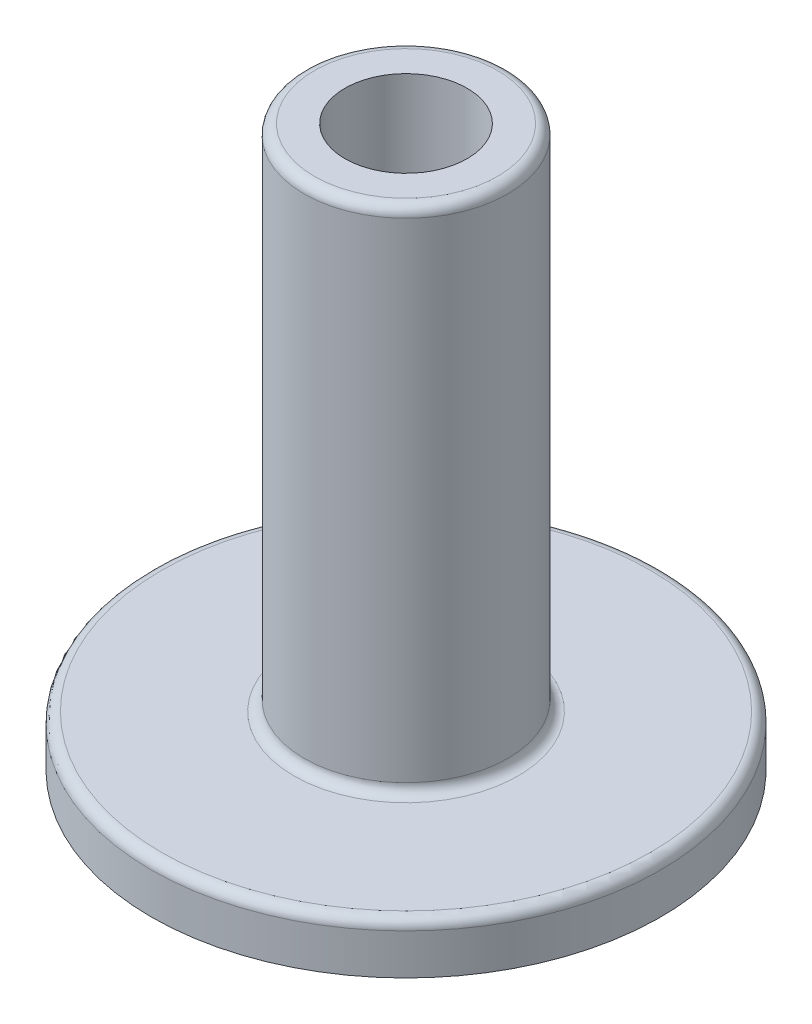
from build123d import *

# Parameters (mm, degrees)
SKETCH1_R           = 25
BOSS_EXTRUDE1_DEPTH = 5
SKETCH2_R           = 10
SKETCH2_R_2         = 6
BOSS_EXTRUDE2_DEPTH = 50
FILLET1_R           = 1


with BuildPart() as part:
    # Sketch1 → Boss-Extrude1 (new body)
    with BuildSketch(Plane(origin=(0, 0, 0), x_dir=(1, 0, 0), z_dir=(0, 1, 0))):
        with Locations(Location((0, 0, 0), (0, 0, 270))):
            Circle(SKETCH1_R)
    extrude(amount=BOSS_EXTRUDE1_DEPTH)

    # Sketch2 → Boss-Extrude2 (add)
    with BuildSketch(Plane(origin=(0, 5, 0), x_dir=(1, 0, 0), z_dir=(0, 1, 0))):
        with Locations(Location((0, 0, 0), (0, 0, 270))):
            Circle(SKETCH2_R)
        with Locations(Location((0, 0, 0), (0, 0, 270))):
            Circle(SKETCH2_R_2, mode=Mode.SUBTRACT)
    extrude(amount=BOSS_EXTRUDE2_DEPTH)

    # Fillet1
    fillet1_edges = [part.edges().sort_by_distance(p)[0] for p in [
        (0, 5, -25),
        (0, 55, -10),
        (0, 5, -10),
    ]]
    fillet(fillet1_edges, radius=FILLET1_R)


solid = part.part
